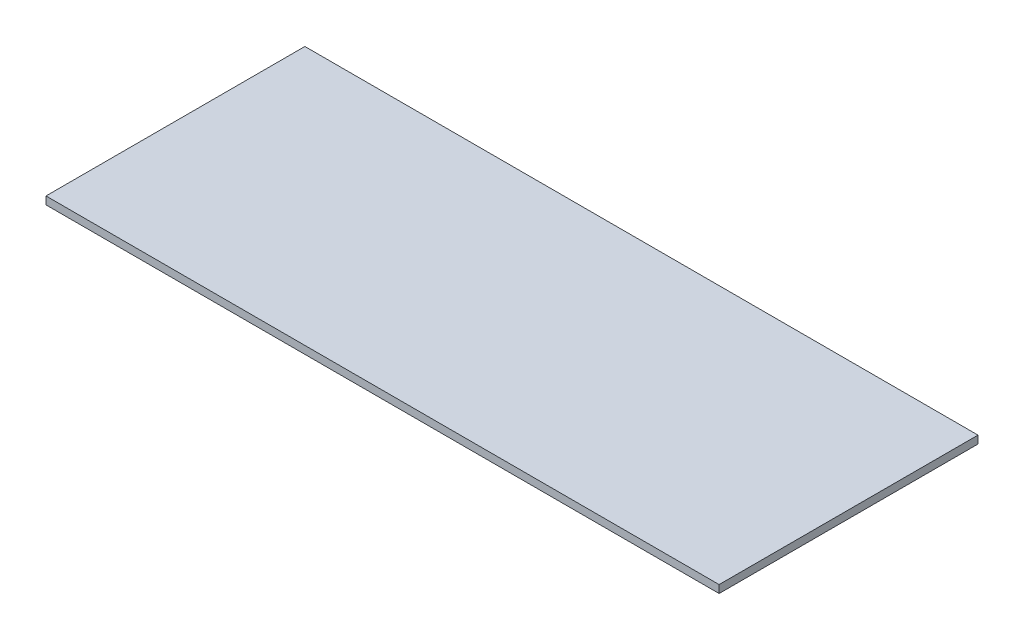
from build123d import *

# Parameters (mm, degrees)
ESBO_O1_W                = 1300
ESBO_O1_H                = 500
RESSALTO_EXTRUS_O1_DEPTH = 15


with BuildPart() as part:
    # Esboço1 → Ressalto-extrusão1 (new body)
    with BuildSketch(Plane(origin=(0, 0, 0), x_dir=(1, 0, 0), z_dir=(0, 1, 0))):
        Rectangle(ESBO_O1_W, ESBO_O1_H)
    extrude(amount=RESSALTO_EXTRUS_O1_DEPTH)


solid = part.part
